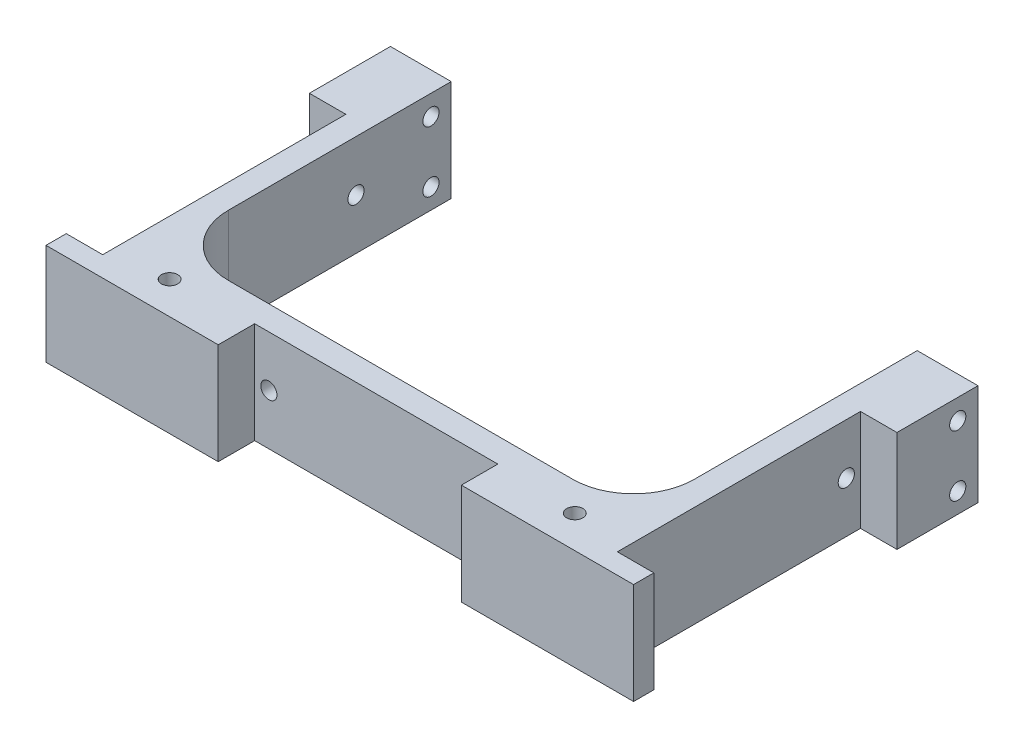
from build123d import *

# Parameters (mm, degrees)
BOSS_EXTRUDE1_DEPTH = 25
SKETCH2_R           = 2
CUT_EXTRUDE1_DEPTH  = 6
SKETCH3_R           = 2
CUT_EXTRUDE2_DEPTH  = 7
CUT_EXTRUDE3_START  = -7
SKETCH10_R          = 2
CUT_EXTRUDE3_DEPTH  = 7
FILLET1_R           = 15
SKETCH13_R          = 2
CUT_EXTRUDE6_DEPTH  = 156.402702679
SKETCH14_R          = 2
CUT_EXTRUDE7_DEPTH  = 92.549167118


with BuildPart() as part:
    # Sketch1 → Boss-Extrude1 (new body)
    with BuildSketch(Plane(origin=(0, 0, 0), x_dir=(1, 0, 0), z_dir=(0, 1, 0))):
        Polygon((63.5, 15), (63.5, -45), (72.5, -45), (72.5, -50), (30, -50), (30, -41), (-30, -41), (-30, -50), (-72.5, -50), (-72.5, -45), (-63.5, -45), (-63.5, 15), (-72.5, 15), (-72.5, 35), (-57.5, 35), (-57.5, -35), (57.5, -35), (57.5, 35), (72.5, 35), (72.5, 15), align=None)
    extrude(amount=BOSS_EXTRUDE1_DEPTH)

    # Sketch2 → Cut-Extrude1 (cut)
    with BuildSketch(Plane.XY.offset(41)):
        with Locations((-26.5, 12.5)):
            Circle(SKETCH2_R)
        with Locations((26.5, 12.5)):
            Circle(SKETCH2_R)
    extrude(amount=-CUT_EXTRUDE1_DEPTH, mode=Mode.SUBTRACT)

    # Sketch3 → Cut-Extrude2 (cut)
    with BuildSketch(Plane.ZY.offset(63.5)):
        with Locations((-11.5, 12.5)):
            Circle(SKETCH3_R)
        with Locations((41.5, 12.5)):
            Circle(SKETCH3_R)
    extrude(amount=-CUT_EXTRUDE2_DEPTH, mode=Mode.SUBTRACT)

    # Sketch10 → Cut-Extrude3 (cut)
    with BuildSketch(Plane(origin=(63.5, 0, 0), x_dir=(0, 0, -1), z_dir=(1, 0, 0)).offset(CUT_EXTRUDE3_START)):
        with Locations(Location((-41.5, 12.5, 0), (0, 0, 180))):
            Circle(SKETCH10_R)
        with Locations(Location((11.5, 12.5, 0), (0, 0, 180))):
            Circle(SKETCH10_R)
    extrude(amount=CUT_EXTRUDE3_DEPTH, mode=Mode.SUBTRACT)

    # Fillet1
    fillet1_edges = [part.edges().sort_by_distance(p)[0] for p in [
        (-57.5, 12.5, 35),
        (57.5, 12.5, 35),
    ]]
    fillet(fillet1_edges, radius=FILLET1_R)

    # Sketch13 → Cut-Extrude6 (cut, through all)
    with BuildSketch(Plane.ZY.offset(72.5)):
        with Locations((-30, 20)):
            Circle(SKETCH13_R)
        with Locations((-30, 5)):
            Circle(SKETCH13_R)
    extrude(amount=-CUT_EXTRUDE6_DEPTH, mode=Mode.SUBTRACT)

    # Sketch14 → Cut-Extrude7 (cut, through all)
    with BuildSketch(Plane(origin=(0, 25, 0), x_dir=(1, 0, 0), z_dir=(0, 1, 0))):
        with Locations(Location((50, -42, 0), (0, 0, 270))):
            Circle(SKETCH14_R)
        with Locations(Location((-50, -42, 0), (0, 0, 270))):
            Circle(SKETCH14_R)
    extrude(amount=-CUT_EXTRUDE7_DEPTH, mode=Mode.SUBTRACT)


solid = part.part
